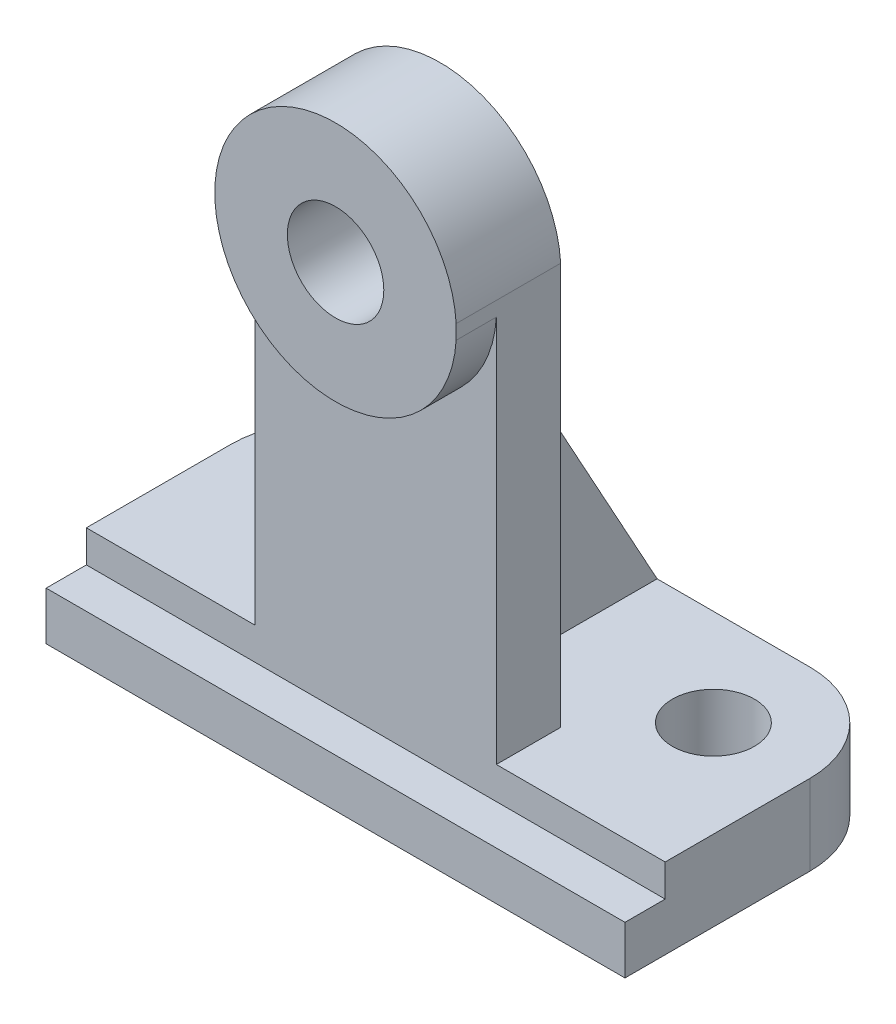
from build123d import *

# Parameters (mm, degrees)
SKETCH1_W               = 72
SKETCH1_H               = 10
BOSS_EXTRUDE1_DEPTH     = 35
CUT_EXTRUDE1_DEPTH      = 81.678373806
CUT_EXTRUDE1_DEPTH_BACK = 81.678373806
SKETCH2_W               = 5
SKETCH2_H               = 4
BOSS_EXTRUDE2_START     = -5
BOSS_EXTRUDE2_DEPTH     = 8
BOSS_EXTRUDE3_DEPTH     = 13
CUT_EXTRUDE2_DEPTH      = 82.444751034
CUT_EXTRUDE2_DEPTH_BACK = 82.444751034
SKETCH5_R               = 6
BOSS_EXTRUDE4_DEPTH     = 5
CUT_EXTRUDE3_DEPTH      = 82.444751034
CUT_EXTRUDE3_DEPTH_BACK = 82.444751034
CUT_EXTRUDE4_DEPTH      = 82.444751034
CUT_EXTRUDE4_DEPTH_BACK = 82.444751034
SKETCH8_R               = 5.1


with BuildPart() as part:
    # Sketch1 → Boss-Extrude1 (new body)
    with BuildSketch(Plane.XY):
        with Locations((0, -5)):
            Rectangle(SKETCH1_W, SKETCH1_H)
    extrude(amount=-BOSS_EXTRUDE1_DEPTH)

    # Sketch2 → Cut-Extrude1 (cut, two sides: drawn at the far end of the back side and taken through both)
    with BuildSketch(Plane(origin=(36, 0, 0), x_dir=(0, 0, -1), z_dir=(1, 0, 0)).offset(-CUT_EXTRUDE1_DEPTH_BACK)):
        with Locations((2.5, -2)):
            Rectangle(SKETCH2_W, SKETCH2_H)
    extrude(amount=CUT_EXTRUDE1_DEPTH + CUT_EXTRUDE1_DEPTH_BACK, mode=Mode.SUBTRACT)

    # Sketch4 → Boss-Extrude2 (add)
    with BuildSketch(Plane.XY.offset(BOSS_EXTRUDE2_START)):
        with BuildLine():
            Line((-15, 48.199642585), (-15, 0))
            Line((-15, 0), (15, 0))
            Line((15, 0), (15, 48.199642585))
            ThreePointArc((15, 48.199642585), (0, 34.072834845), (-15, 48.199642585))
        make_face()
    extrude(amount=-BOSS_EXTRUDE2_DEPTH)

    # Sketch4<5> → Boss-Extrude3 (add)
    with BuildSketch(Plane.XY):
        with BuildLine():
            Line((-15, 50), (-15, 48.199642585))
            ThreePointArc((-15, 48.199642585), (0, 34.072834845), (15, 48.199642585))
            Line((15, 48.199642585), (15, 50))
            ThreePointArc((15, 50), (0, 64.12680774), (-15, 50))
        make_face()
    extrude(amount=-BOSS_EXTRUDE3_DEPTH)

    # Sketch5 → Cut-Extrude2 (cut, two sides: drawn at the far end of the back side and taken through both)
    with BuildSketch(Plane.XY.offset(-CUT_EXTRUDE2_DEPTH_BACK)):
        with Locations((0, 49.099821292)):
            Circle(SKETCH5_R)
    extrude(amount=CUT_EXTRUDE2_DEPTH + CUT_EXTRUDE2_DEPTH_BACK, mode=Mode.SUBTRACT)

    # Sketch6 → Boss-Extrude4 (add, symmetric)
    with BuildSketch(Plane(origin=(0, 0, 0), x_dir=(0, 0, -1), z_dir=(1, 0, 0))):
        Polygon((13, 0), (13, 40), (35, 0), align=None)
    extrude(amount=BOSS_EXTRUDE4_DEPTH, both=True)

    # Sketch7 → Cut-Extrude3 (cut, two sides: drawn at the far end of the back side and taken through both)
    with BuildSketch(Plane(origin=(0, 0, 0), x_dir=(1, 0, 0), z_dir=(0, 1, 0)).offset(-CUT_EXTRUDE3_DEPTH_BACK)):
        with BuildLine():
            Line((-36, 35), (-36, 23))
            ThreePointArc((-36, 23), (-32.485281374, 31.485281374), (-24, 35))
            Line((-24, 35), (-36, 35))
        make_face()
        with BuildLine():
            Line((36, 35), (24, 35))
            ThreePointArc((24, 35), (32.485281374, 31.485281374), (36, 23))
            Line((36, 23), (36, 35))
        make_face()
    extrude(amount=CUT_EXTRUDE3_DEPTH + CUT_EXTRUDE3_DEPTH_BACK, mode=Mode.SUBTRACT)

    # Sketch8 → Cut-Extrude4 (cut, two sides: drawn at the far end of the back side and taken through both)
    with BuildSketch(Plane(origin=(0, 0, 0), x_dir=(1, 0, 0), z_dir=(0, 1, 0)).offset(-CUT_EXTRUDE4_DEPTH_BACK)):
        with Locations((24, 23)):
            Circle(SKETCH8_R)
        with Locations((-24, 23)):
            Circle(SKETCH8_R)
    extrude(amount=CUT_EXTRUDE4_DEPTH + CUT_EXTRUDE4_DEPTH_BACK, mode=Mode.SUBTRACT)


solid = part.part
